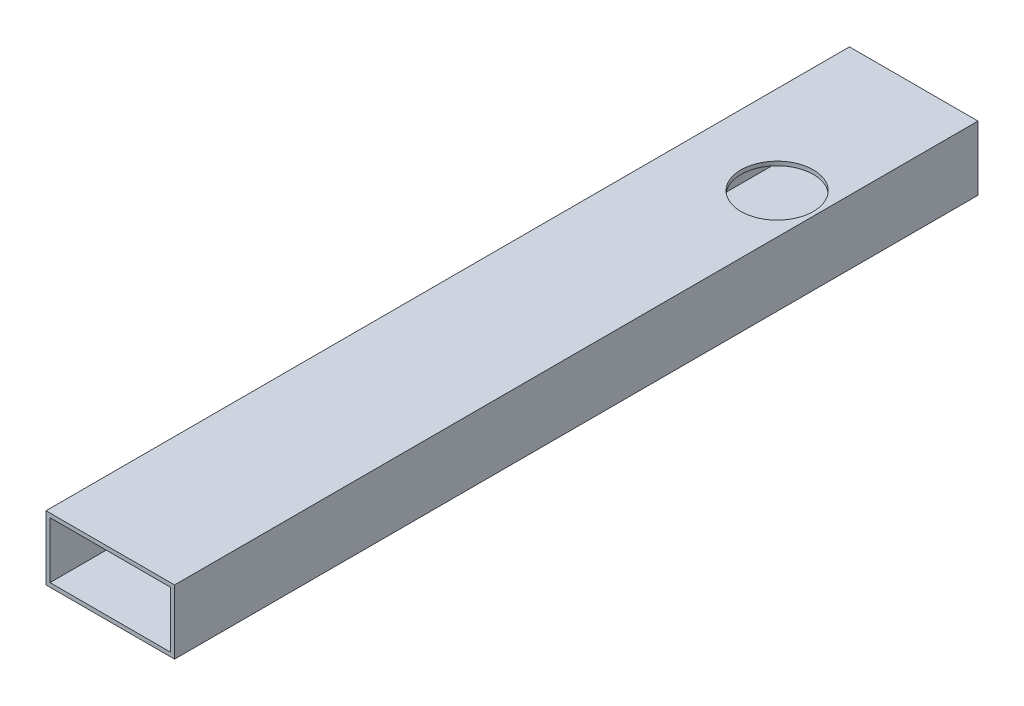
from build123d import *

# Parameters (mm, degrees)
BOSS_EXTRUDE1_DEPTH      = 158.750001
BOSS_EXTRUDE1_DEPTH_BACK = 158.750001
SKETCH3_W                = 50.8
SKETCH3_H                = 25.4
SKETCH3_W_2              = 47.625
SKETCH3_H_2              = 22.225
SKETCH4_R                = 14.2875
CUT_EXTRUDE1_DEPTH       = 39.37


with BuildPart() as part:
    # Sketch3 → Boss-Extrude1 (new, two sides: drawn at the far end of the back side and taken through both)
    with BuildSketch(Plane.XY.offset(-BOSS_EXTRUDE1_DEPTH_BACK)):
        Rectangle(SKETCH3_W, SKETCH3_H)
        Rectangle(SKETCH3_W_2, SKETCH3_H_2, mode=Mode.SUBTRACT)
    extrude(amount=BOSS_EXTRUDE1_DEPTH + BOSS_EXTRUDE1_DEPTH_BACK)

    # Sketch4 → Cut-Extrude1 (cut)
    with BuildSketch(Plane(origin=(0, 12.7, 0), x_dir=(1, 0, 0), z_dir=(0, 1, 0))):
        with Locations(Location((9.525, 95.250000508, 0), (0, 0, 180))):
            Circle(SKETCH4_R)
    extrude(amount=-CUT_EXTRUDE1_DEPTH, mode=Mode.SUBTRACT)


solid = part.part
